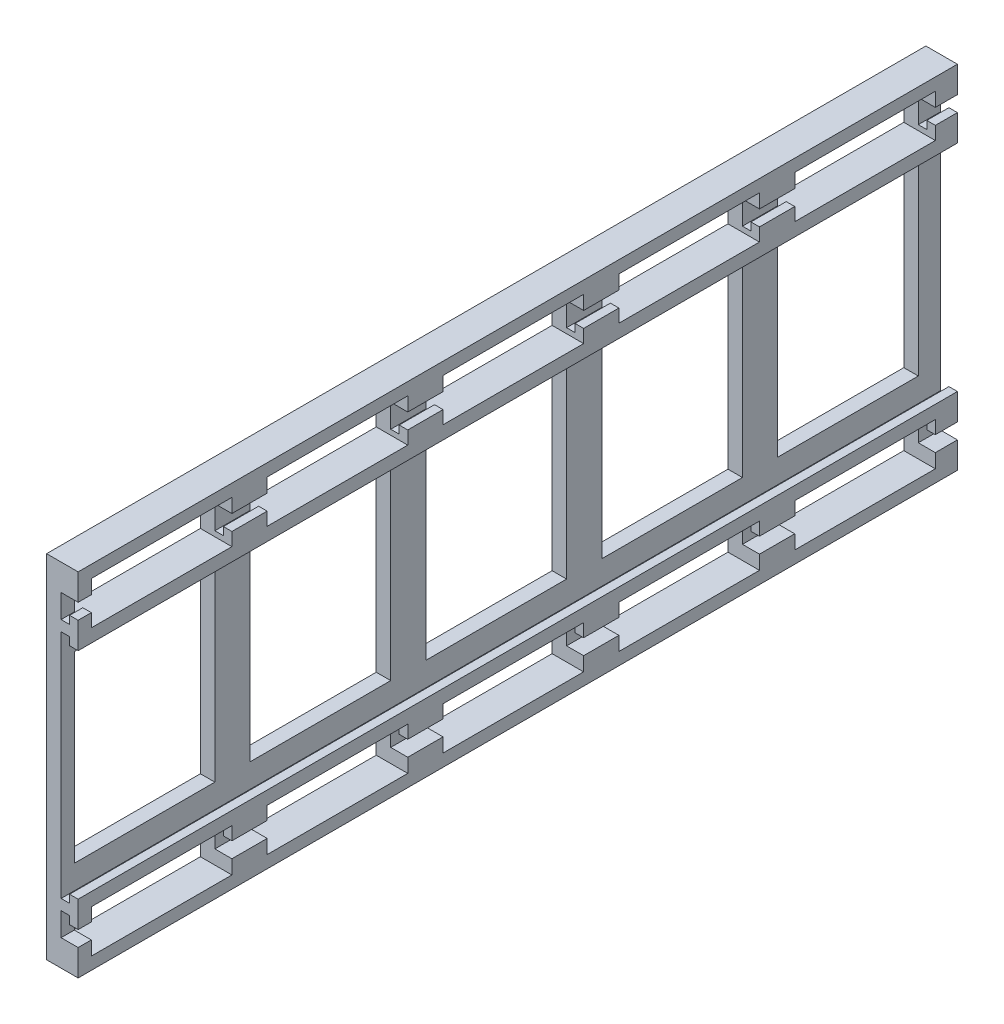
from build123d import *

# Parameters (mm, degrees)
EXTRUDE1_DEPTH = 2540
EXTRUDE2_START = 88.9
SKETCH2_W      = 406.11851991
SKETCH2_H      = 123.339698639
SKETCH2_H_2    = 529.458218549
EXTRUDE2_DEPTH = 2690.004184222


with BuildPart() as part:
    # Sketch1 → Extrude1 (new body)
    with BuildSketch(Plane(origin=(0, 0, 0), x_dir=(0, 1, 0), z_dir=(0, 0, 1))):
        Polygon((-379.260815056, -1250.091692764), (-356.400815056, -1250.091692764), (-356.400815056, -1274.700151443), (-432.600815056, -1274.700151443), (-432.600815056, -1250.091692764), (-409.740815056, -1250.091692764), (-409.740815056, -1225.483234085), (-432.600815056, -1225.483234085), (-477.441999719, -1225.483234085), (-477.441999719, -1274.700151443), (-553.641999719, -1274.700151443), (-553.641999719, -1183.595391403), (462.358000281, -1183.595391403), (462.358000281, -1274.700151443), (386.158000281, -1274.700151443), (386.158000281, -1225.483234085), (341.316815619, -1225.483234085), (318.456815619, -1225.483234085), (318.456815619, -1250.091692764), (341.316815619, -1250.091692764), (341.316815619, -1274.700151443), (265.116815619, -1274.700151443), (265.116815619, -1250.091692764), (287.976815619, -1250.091692764), (287.976815619, -1225.483234085), (265.116815619, -1225.483234085), (-356.400815056, -1225.483234085), (-379.260815056, -1225.483234085), align=None)
    extrude(amount=EXTRUDE1_DEPTH)

    # Sketch2 → Extrude2 (cut, through all)
    with BuildSketch(Plane(origin=(1225.483234085, 0, 0), x_dir=(0, 0, -1), z_dir=(1, 0, 0)).offset(EXTRUDE2_START)):
        with Locations((-1790.833583772, -456.272947628)):
            Rectangle(SKETCH2_W, SKETCH2_H)
        with Locations((-2298.833583772, -456.272947628)):
            Rectangle(SKETCH2_W, SKETCH2_H)
        with Locations((-2298.833583772, -45.641999719)):
            Rectangle(SKETCH2_W, SKETCH2_H_2)
        with Locations((-2298.833583772, 364.98894819)):
            Rectangle(SKETCH2_W, SKETCH2_H)
        with Locations((-1790.833583772, -45.641999719)):
            Rectangle(SKETCH2_W, SKETCH2_H_2)
        with Locations((-1790.833583772, 364.98894819)):
            Rectangle(SKETCH2_W, SKETCH2_H)
        with Locations((-1282.833583772, -456.272947628)):
            Rectangle(SKETCH2_W, SKETCH2_H)
        with Locations((-1282.833583772, -45.641999719)):
            Rectangle(SKETCH2_W, SKETCH2_H_2)
        with Locations((-1282.833583772, 364.98894819)):
            Rectangle(SKETCH2_W, SKETCH2_H)
        with Locations((-774.833583772, -456.272947628)):
            Rectangle(SKETCH2_W, SKETCH2_H)
        with Locations((-774.833583772, -45.641999719)):
            Rectangle(SKETCH2_W, SKETCH2_H_2)
        with Locations((-774.833583772, 364.98894819)):
            Rectangle(SKETCH2_W, SKETCH2_H)
        with Locations((-266.833583772, -456.272947628)):
            Rectangle(SKETCH2_W, SKETCH2_H)
        with Locations((-266.833583772, -45.641999719)):
            Rectangle(SKETCH2_W, SKETCH2_H_2)
        with Locations((-266.833583772, 364.98894819)):
            Rectangle(SKETCH2_W, SKETCH2_H)
    extrude(amount=-EXTRUDE2_DEPTH, mode=Mode.SUBTRACT)


solid = part.part
